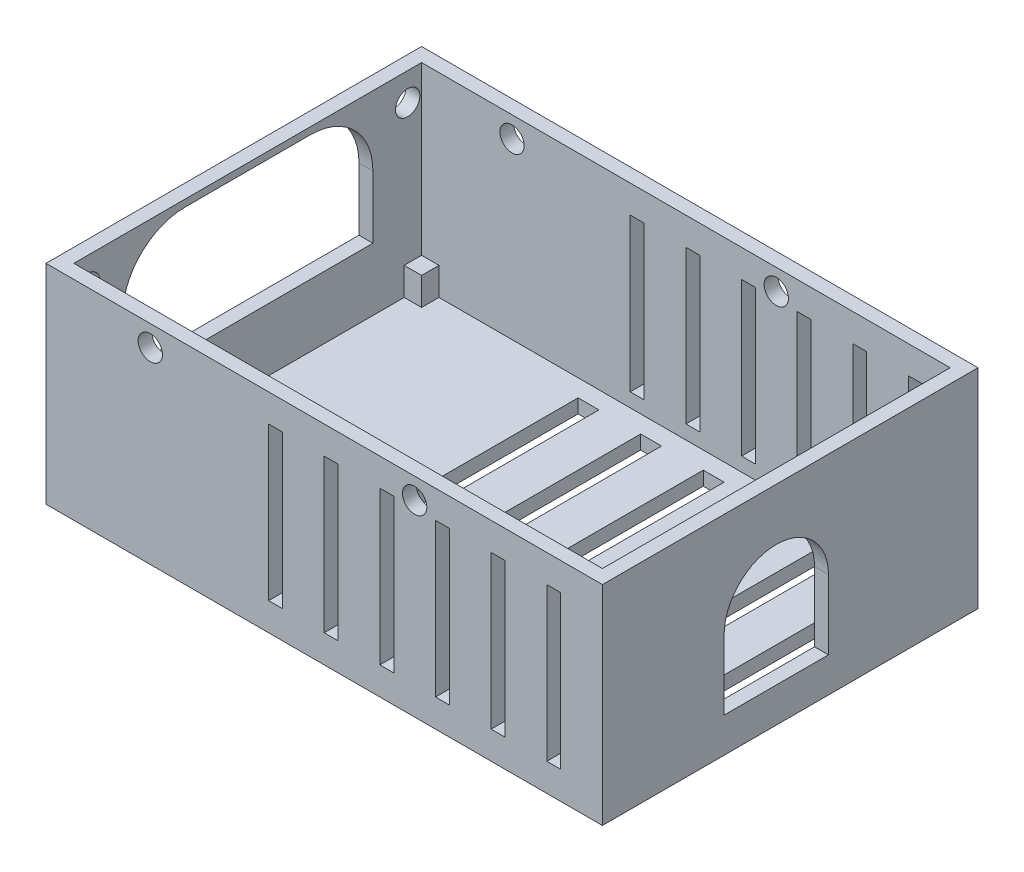
from build123d import *

# Parameters (mm, degrees)
SKETCH1_W           = 80
SKETCH1_H           = 54
BOSS_EXTRUDE1_DEPTH = 30
SKETCH2_W           = 76
SKETCH2_H           = 50
CUT_EXTRUDE1_DEPTH  = 28
CUT_EXTRUDE2_DEPTH  = 6
SKETCH4_W           = 36
SKETCH4_H           = 18
CUT_EXTRUDE3_DEPTH  = 6
SKETCH5_W           = 2.5
SKETCH5_H           = 2.5
STANDOFFS_DEPTH     = 4
FILLET3_R           = 9
FILLET4_R           = 9
SKETCH6_W           = 3
SKETCH6_H           = 45
BOTTOM_GRILL_DEPTH  = 2
CUT_EXTRUDE5_REACH  = 75.593
SKETCH7_W           = 2
SKETCH7_H           = 22
CUT_EXTRUDE6_START  = -54
SKETCH8_R           = 1.75
CUT_EXTRUDE6_DEPTH  = 54
SKETCH9_R           = 1.75
CUT_EXTRUDE7_DEPTH  = 2


with BuildPart() as part:
    # Sketch1 → Boss-Extrude1 (new body)
    with BuildSketch(Plane(origin=(0, 0, 0), x_dir=(1, 0, 0), z_dir=(0, 1, 0))):
        Rectangle(SKETCH1_W, SKETCH1_H)
    extrude(amount=BOSS_EXTRUDE1_DEPTH)

    # Sketch2 → Cut-Extrude1 (cut)
    with BuildSketch(Plane(origin=(0, 30, 0), x_dir=(1, 0, 0), z_dir=(0, 1, 0))):
        Rectangle(SKETCH2_W, SKETCH2_H)
    extrude(amount=-CUT_EXTRUDE1_DEPTH, mode=Mode.SUBTRACT)

    # Sketch3 → Cut-Extrude2 (cut)
    with BuildSketch(Plane(origin=(40, 0, 0), x_dir=(0, 0, -1), z_dir=(1, 0, 0))):
        with BuildLine():
            Line((5.5, 15), (5.5, 5))
            Line((5.5, 5), (-9.5, 5))
            Line((-9.5, 5), (-9.5, 15))
            ThreePointArc((-9.5, 15), (-2, 22.5), (5.5, 15))
        make_face()
    extrude(amount=-CUT_EXTRUDE2_DEPTH, mode=Mode.SUBTRACT)

    # Sketch4 → Cut-Extrude3 (cut)
    with BuildSketch(Plane.ZY.offset(40)):
        with Locations((0, 20)):
            Rectangle(SKETCH4_W, SKETCH4_H)
    extrude(amount=-CUT_EXTRUDE3_DEPTH, mode=Mode.SUBTRACT)

    # Sketch5 → Standoffs (add)
    with BuildSketch(Plane(origin=(0, 2, 0), x_dir=(1, 0, 0), z_dir=(0, 1, 0))):
        with Locations((36.75, 23.75)):
            Rectangle(SKETCH5_W, SKETCH5_H)
        with Locations((36.75, -23.75)):
            Rectangle(SKETCH5_W, SKETCH5_H)
        with Locations((-36.75, -23.75)):
            Rectangle(SKETCH5_W, SKETCH5_H)
        with Locations((-36.75, 23.75)):
            Rectangle(SKETCH5_W, SKETCH5_H)
    extrude(amount=STANDOFFS_DEPTH)

    # Fillet3
    fillet3_edges = [part.edges().sort_by_distance(p)[0] for p in [
        (-39, 29, -18),
    ]]
    fillet(fillet3_edges, radius=FILLET3_R)

    # Fillet4
    fillet4_edges = [part.edges().sort_by_distance(p)[0] for p in [
        (-39, 29, 18),
    ]]
    fillet(fillet4_edges, radius=FILLET4_R)

    # Sketch6 → Bottom Grill (cut)
    with BuildSketch(Plane.XZ):
        with Locations((33.5, 0)):
            Rectangle(SKETCH6_W, SKETCH6_H)
        with Locations((24.5, 0)):
            Rectangle(SKETCH6_W, SKETCH6_H)
        with Locations((15.5, 0)):
            Rectangle(SKETCH6_W, SKETCH6_H)
        with Locations((6.5, 0)):
            Rectangle(SKETCH6_W, SKETCH6_H)
        with Locations((-2.5, 0)):
            Rectangle(SKETCH6_W, SKETCH6_H)
        with Locations((-11.5, 0)):
            Rectangle(SKETCH6_W, SKETCH6_H)
    extrude(amount=-BOTTOM_GRILL_DEPTH, mode=Mode.SUBTRACT)

    # Cut-Extrude5: up to this face of the body (flat: up to its plane)
    cut_extrude5_end = Plane(part.part.faces().sort_by_distance((0, 15, 27))[0])
    # Sketch7 → Cut-Extrude5 (cut, up to the picked face)
    with BuildSketch(Plane(origin=(0, 0, -27), x_dir=(-1, 0, 0), z_dir=(0, 0, -1)), mode=Mode.PRIVATE) as cut_extrude5_sk1:
        with Locations((-33, 15)):
            Rectangle(SKETCH7_W, SKETCH7_H)
    cut_extrude5_tool1 = split(extrude(cut_extrude5_sk1.sketch, amount=-CUT_EXTRUDE5_REACH, mode=Mode.PRIVATE), bisect_by=cut_extrude5_end, keep=Keep.BOTH, mode=Mode.PRIVATE)
    # Sketch7 → Cut-Extrude5 (cut, up to the picked face)
    with BuildSketch(Plane(origin=(0, 0, -27), x_dir=(-1, 0, 0), z_dir=(0, 0, -1)), mode=Mode.PRIVATE) as cut_extrude5_sk2:
        with Locations((-25, 15)):
            Rectangle(SKETCH7_W, SKETCH7_H)
    cut_extrude5_tool2 = split(extrude(cut_extrude5_sk2.sketch, amount=-CUT_EXTRUDE5_REACH, mode=Mode.PRIVATE), bisect_by=cut_extrude5_end, keep=Keep.BOTH, mode=Mode.PRIVATE)
    # Sketch7 → Cut-Extrude5 (cut, up to the picked face)
    with BuildSketch(Plane(origin=(0, 0, -27), x_dir=(-1, 0, 0), z_dir=(0, 0, -1)), mode=Mode.PRIVATE) as cut_extrude5_sk3:
        with Locations((-17, 15)):
            Rectangle(SKETCH7_W, SKETCH7_H)
    cut_extrude5_tool3 = split(extrude(cut_extrude5_sk3.sketch, amount=-CUT_EXTRUDE5_REACH, mode=Mode.PRIVATE), bisect_by=cut_extrude5_end, keep=Keep.BOTH, mode=Mode.PRIVATE)
    # Sketch7 → Cut-Extrude5 (cut, up to the picked face)
    with BuildSketch(Plane(origin=(0, 0, -27), x_dir=(-1, 0, 0), z_dir=(0, 0, -1)), mode=Mode.PRIVATE) as cut_extrude5_sk4:
        with Locations((-9, 15)):
            Rectangle(SKETCH7_W, SKETCH7_H)
    cut_extrude5_tool4 = split(extrude(cut_extrude5_sk4.sketch, amount=-CUT_EXTRUDE5_REACH, mode=Mode.PRIVATE), bisect_by=cut_extrude5_end, keep=Keep.BOTH, mode=Mode.PRIVATE)
    # Sketch7 → Cut-Extrude5 (cut, up to the picked face)
    with BuildSketch(Plane(origin=(0, 0, -27), x_dir=(-1, 0, 0), z_dir=(0, 0, -1)), mode=Mode.PRIVATE) as cut_extrude5_sk5:
        with Locations((-1, 15)):
            Rectangle(SKETCH7_W, SKETCH7_H)
    cut_extrude5_tool5 = split(extrude(cut_extrude5_sk5.sketch, amount=-CUT_EXTRUDE5_REACH, mode=Mode.PRIVATE), bisect_by=cut_extrude5_end, keep=Keep.BOTH, mode=Mode.PRIVATE)
    # Sketch7 → Cut-Extrude5 (cut, up to the picked face)
    with BuildSketch(Plane(origin=(0, 0, -27), x_dir=(-1, 0, 0), z_dir=(0, 0, -1)), mode=Mode.PRIVATE) as cut_extrude5_sk6:
        with Locations((7, 15)):
            Rectangle(SKETCH7_W, SKETCH7_H)
    cut_extrude5_tool6 = split(extrude(cut_extrude5_sk6.sketch, amount=-CUT_EXTRUDE5_REACH, mode=Mode.PRIVATE), bisect_by=cut_extrude5_end, keep=Keep.BOTH, mode=Mode.PRIVATE)
    add(cut_extrude5_tool1.solids().sort_by(Axis((33, 15, -27), (0, 0, 1)))[0], mode=Mode.SUBTRACT)
    add(cut_extrude5_tool2.solids().sort_by(Axis((25, 15, -27), (0, 0, 1)))[0], mode=Mode.SUBTRACT)
    add(cut_extrude5_tool3.solids().sort_by(Axis((17, 15, -27), (0, 0, 1)))[0], mode=Mode.SUBTRACT)
    add(cut_extrude5_tool4.solids().sort_by(Axis((9, 15, -27), (0, 0, 1)))[0], mode=Mode.SUBTRACT)
    add(cut_extrude5_tool5.solids().sort_by(Axis((1, 15, -27), (0, 0, 1)))[0], mode=Mode.SUBTRACT)
    add(cut_extrude5_tool6.solids().sort_by(Axis((-7, 15, -27), (0, 0, 1)))[0], mode=Mode.SUBTRACT)

    # Sketch8 → Cut-Extrude6 (cut)
    with BuildSketch(Plane(origin=(0, 0, -27), x_dir=(-1, 0, 0), z_dir=(0, 0, -1)).offset(CUT_EXTRUDE6_START)):
        with Locations((-13, 27)):
            Circle(SKETCH8_R)
        with Locations((25, 27)):
            Circle(SKETCH8_R)
    extrude(amount=CUT_EXTRUDE6_DEPTH, mode=Mode.SUBTRACT)

    # Sketch9 → Cut-Extrude7 (cut)
    with BuildSketch(Plane.ZY.offset(40)):
        with Locations((-23, 26)):
            Circle(SKETCH9_R)
        with Locations((23, 26)):
            Circle(SKETCH9_R)
    extrude(amount=-CUT_EXTRUDE7_DEPTH, mode=Mode.SUBTRACT)


solid = part.part
